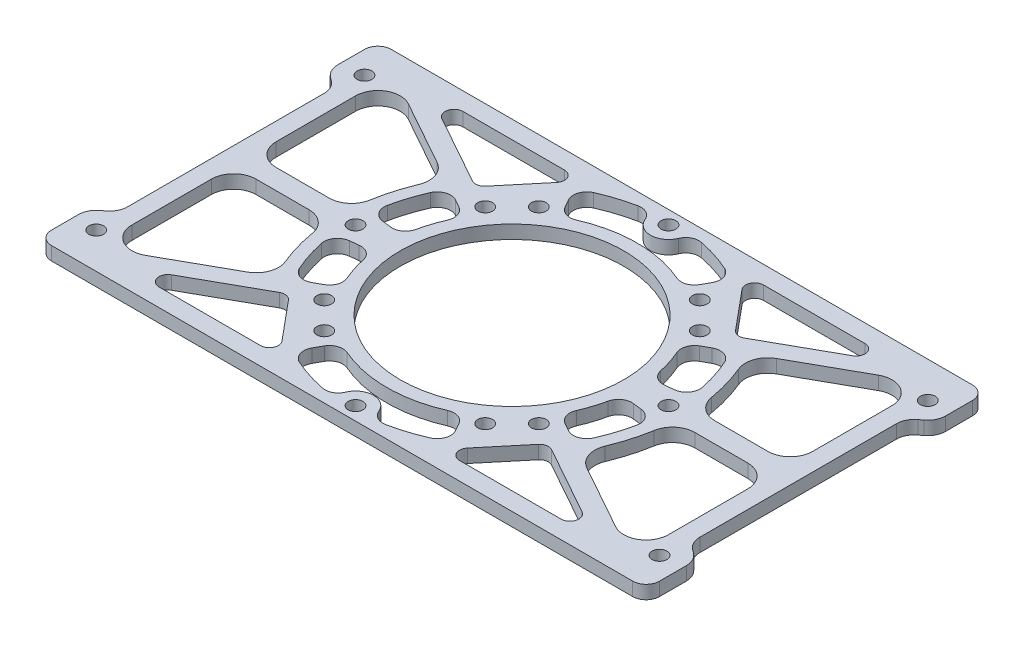
from build123d import *

# Parameters (mm, degrees)
SKETCH_1_W          = 136
SKETCH_1_H          = 76
SKETCH_1_R          = 25
SKETCH_1_R_2        = 1.65
EXTRUDE_1_DEPTH     = 3
FILLET_2_R          = 3
FILLET_3_R          = 5
CUT_EXTRUDE_1_DEPTH = 10
FILLET_4_R          = 2
CUT_EXTRUDE_2_DEPTH = 78.955115291
FILLET_5_R          = 3
FILLET_6_R          = 4


with BuildPart() as part:
    # 草图1 → 凸台-拉伸1 (new body)
    with BuildSketch(Plane(origin=(0, 0, 0), x_dir=(1, 0, 0), z_dir=(0, 1, 0))):
        Rectangle(SKETCH_1_W, SKETCH_1_H)
        with Locations(Location((0, 0, 0), (0, 0, 270))):
            Circle(SKETCH_1_R, mode=Mode.SUBTRACT)
        with Locations(Location((-63, 30, 0), (0, 0, 270))):
            Circle(SKETCH_1_R_2, mode=Mode.SUBTRACT)
        with Locations(Location((-63, -30, 0), (0, 0, 270))):
            Circle(SKETCH_1_R_2, mode=Mode.SUBTRACT)
        with Locations(Location((-18, 24, 0), (0, 0, 270))):
            Circle(SKETCH_1_R_2, mode=Mode.SUBTRACT)
        with Locations(Location((18, 24, 0), (0, 0, 270))):
            Circle(SKETCH_1_R_2, mode=Mode.SUBTRACT)
        with Locations(Location((-24, 18, 0), (0, 0, 270))):
            Circle(SKETCH_1_R_2, mode=Mode.SUBTRACT)
        with Locations(Location((24, 18, 0), (0, 0, 270))):
            Circle(SKETCH_1_R_2, mode=Mode.SUBTRACT)
        with Locations(Location((24, -18, 0), (0, 0, 270))):
            Circle(SKETCH_1_R_2, mode=Mode.SUBTRACT)
        with Locations(Location((18, -24, 0), (0, 0, 270))):
            Circle(SKETCH_1_R_2, mode=Mode.SUBTRACT)
        with Locations(Location((-18, -24, 0), (0, 0, 270))):
            Circle(SKETCH_1_R_2, mode=Mode.SUBTRACT)
        with Locations(Location((-24, -18, 0), (0, 0, 270))):
            Circle(SKETCH_1_R_2, mode=Mode.SUBTRACT)
        with Locations(Location((63, -30, 0), (0, 0, 90))):
            Circle(SKETCH_1_R_2, mode=Mode.SUBTRACT)
        with Locations(Location((63, 30, 0), (0, 0, 90))):
            Circle(SKETCH_1_R_2, mode=Mode.SUBTRACT)
        with Locations(Location((0, 35, 0), (0, 0, 270))):
            Circle(SKETCH_1_R_2, mode=Mode.SUBTRACT)
        with Locations(Location((35, 0, 0), (0, 0, 270))):
            Circle(SKETCH_1_R_2, mode=Mode.SUBTRACT)
        with Locations(Location((0, -35, 0), (0, 0, 270))):
            Circle(SKETCH_1_R_2, mode=Mode.SUBTRACT)
        with Locations(Location((-35, 0, 0), (0, 0, 270))):
            Circle(SKETCH_1_R_2, mode=Mode.SUBTRACT)
        with BuildLine():
            Line((-33.826559933, 18.90307761), (-60, 33.529411765))
            Line((-60, 33.529411765), (-60, 2.25))
            Line((-60, 2.25), (-38.684622268, 2.25))
            ThreePointArc((-38.684622268, 2.25), (-37.199450728, 10.851883039), (-33.826559933, 18.90307761))
        make_face(mode=Mode.SUBTRACT)
        with BuildLine():
            Line((-60, -33.529411765), (-33.826559933, -18.90307761))
            ThreePointArc((-33.826559933, -18.90307761), (-37.199450728, -10.851883039), (-38.684622268, -2.25))
            Line((-38.684622268, -2.25), (-60, -2.25))
            Line((-60, -2.25), (-60, -33.529411765))
        make_face(mode=Mode.SUBTRACT)
        with BuildLine():
            Line((60, -2.25), (60, -33.529411765))
            Line((60, -33.529411765), (33.826559933, -18.90307761))
            ThreePointArc((33.826559933, -18.90307761), (37.199450728, -10.851883039), (38.684622268, -2.25))
            Line((38.684622268, -2.25), (60, -2.25))
        make_face(mode=Mode.SUBTRACT)
        with BuildLine():
            Line((60, 2.25), (60, 33.529411765))
            Line((60, 33.529411765), (33.826559933, 18.90307761))
            ThreePointArc((33.826559933, 18.90307761), (37.199450728, 10.851883039), (38.684622268, 2.25))
            Line((38.684622268, 2.25), (60, 2.25))
        make_face(mode=Mode.SUBTRACT)
    extrude(amount=EXTRUDE_1_DEPTH)

    # 圆角2
    fillet_2_edges = [part.edges().sort_by_distance(p)[0] for p in [
        (68, 1.5, 38),
        (-68, 1.5, 38),
        (-68, 1.5, -38),
        (68, 1.5, -38),
    ]]
    fillet(fillet_2_edges, radius=FILLET_2_R)

    # 圆角3
    fillet_3_edges = [part.edges().sort_by_distance(p)[0] for p in [
        (60, 1.5, 2.25),
        (38.684622268, 1.5, 2.25),
        (33.826559933, 1.5, 18.90307761),
        (60, 1.5, 33.529411765),
        (38.684622268, 1.5, -2.25),
        (60, 1.5, -2.25),
        (60, 1.5, -33.529411765),
        (33.826559933, 1.5, -18.90307761),
        (-38.684622268, 1.5, -2.25),
        (-33.826559933, 1.5, -18.90307761),
        (-60, 1.5, -33.529411765),
        (-60, 1.5, -2.25),
        (-60, 1.5, 2.25),
        (-60, 1.5, 33.529411765),
        (-33.826559933, 1.5, 18.90307761),
        (-38.684622268, 1.5, 2.25),
    ]]
    fillet(fillet_3_edges, radius=FILLET_3_R)

    # 草图2 → 切除-拉伸1 (cut)
    with BuildSketch(Plane(origin=(0, 3, 0), x_dir=(1, 0, 0), z_dir=(0, 1, 0))):
        Polygon((-52.642382276, 34), (-29, 20.788080493), (-18, 34), align=None)
        Polygon((-18, -34), (-52.642382276, -34), (-29, -20.788080493), align=None)
        Polygon((52.642382276, -34), (29, -20.788080493), (18, -34), align=None)
        Polygon((18, 34), (52.642382276, 34), (29, 20.788080493), align=None)
    extrude(amount=-CUT_EXTRUDE_1_DEPTH, mode=Mode.SUBTRACT)

    # 圆角4
    fillet_4_edges = [part.edges().sort_by_distance(p)[0] for p in [
        (29, 1.5, -20.788080493),
        (18, 1.5, -34),
        (52.642382276, 1.5, -34),
        (52.642382276, 1.5, 34),
        (18, 1.5, 34),
        (29, 1.5, 20.788080493),
        (-29, 1.5, 20.788080493),
        (-18, 1.5, 34),
        (-52.642382276, 1.5, 34),
        (-52.642382276, 1.5, -34),
        (-18, 1.5, -34),
        (-29, 1.5, -20.788080493),
    ]]
    fillet(fillet_4_edges, radius=FILLET_4_R)

    # 草图3 → 切除-拉伸2 (cut, through all)
    with BuildSketch(Plane(origin=(0, 3, 0), x_dir=(1, 0, 0), z_dir=(0, 1, 0))):
        with BuildLine():
            Line((-35.764125224, 4.114285714), (-27.816541841, 3.2))
            ThreePointArc((-27.816541841, 3.2), (-26.646890195, 8.599025696), (-24.439995996, 13.66333033))
            Line((-24.439995996, 13.66333033), (-31.422851995, 17.567138996))
            ThreePointArc((-31.422851995, 17.567138996), (-34.260287394, 11.05589018), (-35.764125224, 4.114285714))
        make_face()
        with BuildLine():
            Line((-35.764125224, -4.114285714), (-27.816541841, -3.2))
            ThreePointArc((-27.816541841, -3.2), (-26.646890195, -8.599025696), (-24.439995996, -13.66333033))
            Line((-24.439995996, -13.66333033), (-31.422851995, -17.567138996))
            ThreePointArc((-31.422851995, -17.567138996), (-34.260287394, -11.05589018), (-35.764125224, -4.114285714))
        make_face()
        with BuildLine():
            Line((35.764125224, -4.114285714), (27.816541841, -3.2))
            ThreePointArc((27.816541841, -3.2), (26.646890195, -8.599025696), (24.439995996, -13.66333033))
            Line((24.439995996, -13.66333033), (31.422851995, -17.567138996))
            ThreePointArc((31.422851995, -17.567138996), (34.260287394, -11.05589018), (35.764125224, -4.114285714))
        make_face()
        with BuildLine():
            Line((35.764125224, 4.114285714), (27.816541841, 3.2))
            ThreePointArc((27.816541841, 3.2), (26.646890195, 8.599025696), (24.439995996, 13.66333033))
            Line((24.439995996, 13.66333033), (31.422851995, 17.567138996))
            ThreePointArc((31.422851995, 17.567138996), (34.260287394, 11.05589018), (35.764125224, 4.114285714))
        make_face()
        Polygon((-68, 27), (-64, 24), (-64, -24), (-68, -27), align=None)
        Polygon((64, -24), (68, -27), (68, 27), (64, 24), align=None)
        with BuildLine():
            Line((-13.66333033, 24.439995996), (-17.567138996, 31.422851995))
            ThreePointArc((-17.567138996, 31.422851995), (-10.963812978, 34.289864464), (-3.922072547, 35.785714286))
            ThreePointArc((-3.922072547, 35.785714286), (0, 31), (3.922072547, 35.785714286))
            ThreePointArc((3.922072547, 35.785714286), (10.963812978, 34.289864464), (17.567138996, 31.422851995))
            Line((17.567138996, 31.422851995), (13.66333033, 24.439995996))
            ThreePointArc((13.66333033, 24.439995996), (0, 28), (-13.66333033, 24.439995996))
        make_face()
        with BuildLine():
            Line((-13.66333033, -24.439995996), (-17.567138996, -31.422851995))
            ThreePointArc((-17.567138996, -31.422851995), (-10.963812978, -34.289864464), (-3.922072547, -35.785714286))
            ThreePointArc((-3.922072547, -35.785714286), (0, -31), (3.922072547, -35.785714286))
            ThreePointArc((3.922072547, -35.785714286), (10.963812978, -34.289864464), (17.567138996, -31.422851995))
            Line((17.567138996, -31.422851995), (13.66333033, -24.439995996))
            ThreePointArc((13.66333033, -24.439995996), (0, -28), (-13.66333033, -24.439995996))
        make_face()
    extrude(amount=-CUT_EXTRUDE_2_DEPTH, mode=Mode.SUBTRACT)

    # 圆角5
    fillet_5_edges = [part.edges().sort_by_distance(p)[0] for p in [
        (35.764125224, 1.5, 4.114285714),
        (31.422851995, 1.5, 17.567138996),
        (24.439995996, 1.5, 13.66333033),
        (27.816541841, 1.5, 3.2),
        (-27.816541841, 1.5, 3.2),
        (-24.439995996, 1.5, 13.66333033),
        (-31.422851995, 1.5, 17.567138996),
        (-35.764125224, 1.5, 4.114285714),
        (27.816541841, 1.5, -3.2),
        (24.439995996, 1.5, -13.66333033),
        (31.422851995, 1.5, -17.567138996),
        (35.764125224, 1.5, -4.114285714),
        (3.922072547, 1.5, -35.785714286),
        (17.567138996, 1.5, -31.422851995),
        (13.66333033, 1.5, -24.439995996),
        (-13.66333033, 1.5, -24.439995996),
        (-17.567138996, 1.5, -31.422851995),
        (-3.922072547, 1.5, -35.785714286),
        (-13.66333033, 1.5, 24.439995996),
        (13.66333033, 1.5, 24.439995996),
        (17.567138996, 1.5, 31.422851995),
        (3.922072547, 1.5, 35.785714286),
        (-3.922072547, 1.5, 35.785714286),
        (-17.567138996, 1.5, 31.422851995),
        (-35.764125224, 1.5, -4.114285714),
        (-31.422851995, 1.5, -17.567138996),
        (-24.439995996, 1.5, -13.66333033),
        (-27.816541841, 1.5, -3.2),
    ]]
    fillet(fillet_5_edges, radius=FILLET_5_R)

    # 圆角6
    fillet_6_edges = [part.edges().sort_by_distance(p)[0] for p in [
        (-64, 1.5, 24),
        (-68, 1.5, 27),
        (-68, 1.5, -27),
        (-64, 1.5, -24),
        (64, 1.5, 24),
        (64, 1.5, -24),
        (68, 1.5, -27),
        (68, 1.5, 27),
    ]]
    fillet(fillet_6_edges, radius=FILLET_6_R)


solid = part.part
